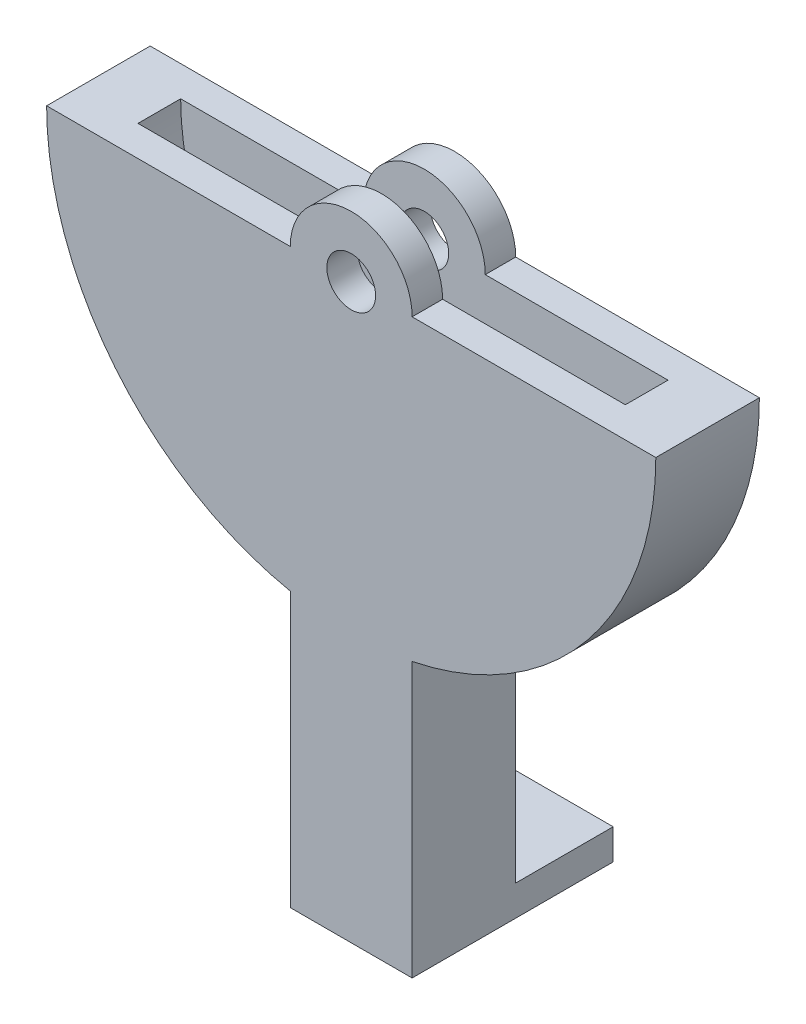
from build123d import *

# Parameters (mm, degrees)
SKETCH1_R           = 4
BOSS_EXTRUDE1_DEPTH = 5
BOSS_EXTRUDE2_DEPTH = 7
SKETCH3_R           = 4
BOSS_EXTRUDE3_DEPTH = 5
BOSS_EXTRUDE4_START = -17
BOSS_EXTRUDE4_DEPTH = 17
SKETCH5_W           = 20
SKETCH5_H           = 33
BOSS_EXTRUDE5_DEPTH = 5


with BuildPart() as part:
    # Sketch1 → Boss-Extrude1 (new body)
    with BuildSketch(Plane.XY):
        with BuildLine():
            Line((-50, 0), (-10, 0))
            ThreePointArc((-10, 0), (0, 10), (10, 0))
            Line((10, 0), (50, 0))
            ThreePointArc((50, 0), (0, -50), (-50, 0))
        make_face()
        Circle(SKETCH1_R, mode=Mode.SUBTRACT)
    extrude(amount=BOSS_EXTRUDE1_DEPTH)

    # Sketch2 → Boss-Extrude2 (add)
    with BuildSketch(Plane.XY.offset(5)):
        with BuildLine():
            Line((-50, 0), (-40, 0))
            ThreePointArc((-40, 0), (0, -40), (40, 0))
            Line((40, 0), (50, 0))
            ThreePointArc((50, 0), (0, -50), (-50, 0))
        make_face()
    extrude(amount=BOSS_EXTRUDE2_DEPTH)

    # Sketch3 → Boss-Extrude3 (add)
    with BuildSketch(Plane.XY.offset(12)):
        with BuildLine():
            Line((-50, 0), (-10, 0))
            ThreePointArc((-10, 0), (0, 10), (10, 0))
            Line((10, 0), (50, 0))
            ThreePointArc((50, 0), (0, -50), (-50, 0))
        make_face()
        Circle(SKETCH3_R, mode=Mode.SUBTRACT)
    extrude(amount=BOSS_EXTRUDE3_DEPTH)

    # Sketch4 → Boss-Extrude4 (add)
    with BuildSketch(Plane.XY.offset(17).offset(BOSS_EXTRUDE4_START)):
        with BuildLine():
            Line((-10, -88.989794856), (10, -88.989794856))
            Line((10, -88.989794856), (10, -48.989794856))
            ThreePointArc((10, -48.989794856), (0, -50), (-10, -48.989794856))
            Line((-10, -48.989794856), (-10, -88.989794856))
        make_face()
    extrude(amount=BOSS_EXTRUDE4_DEPTH)

    # Sketch5 → Boss-Extrude5 (add)
    with BuildSketch(Plane.XZ.offset(88.989794856)):
        with Locations((0, 0.5)):
            Rectangle(SKETCH5_W, SKETCH5_H)
    extrude(amount=BOSS_EXTRUDE5_DEPTH)


solid = part.part
